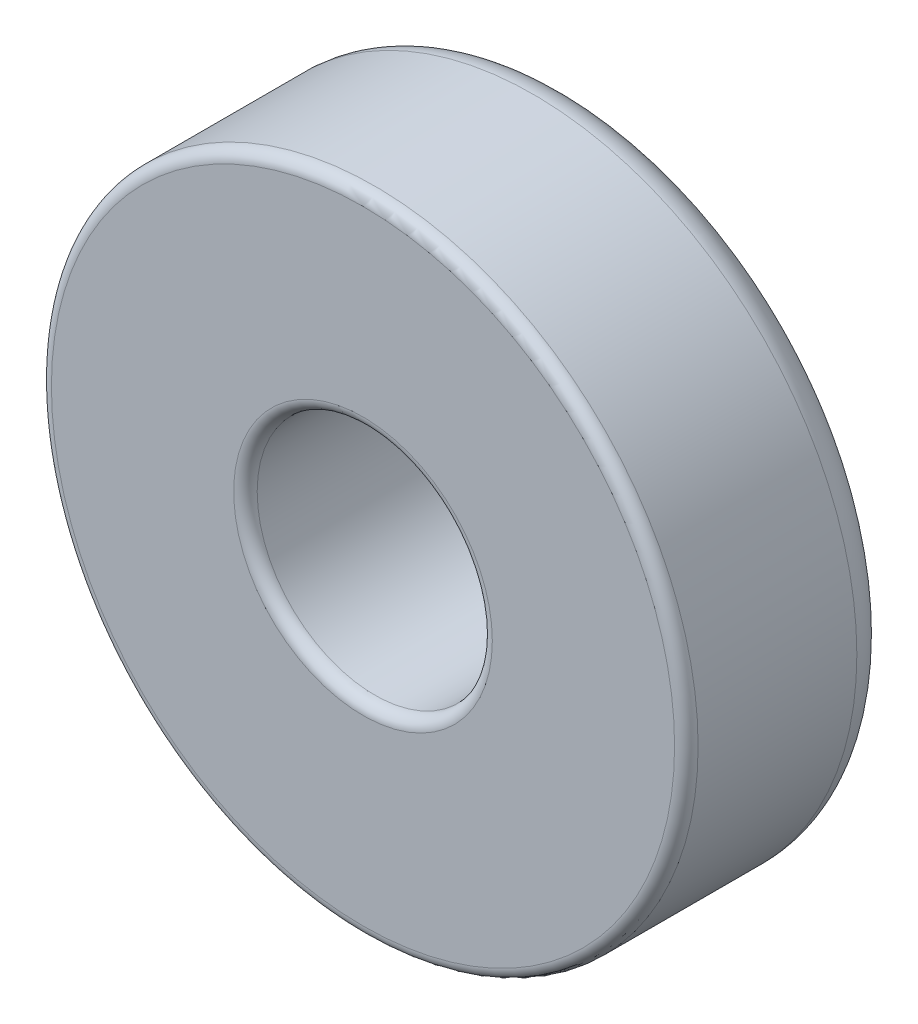
from build123d import *

# Parameters (mm, degrees)
SKETCH_1_R      = 2.75
SKETCH_1_R_2    = 1
EXTRUDE_1_DEPTH = 1.75
FILLET_1_R      = 0.3
FILLET_2_R      = 0.1


with BuildPart() as part:
    # 草图1 → 拉伸-薄壁1 (new body)
    with BuildSketch(Plane.XY):
        Circle(SKETCH_1_R)
        Circle(SKETCH_1_R_2, mode=Mode.SUBTRACT)
    extrude(amount=EXTRUDE_1_DEPTH)

    # 圆角1
    fillet_1_edges = [part.edges().sort_by_distance(p)[0] for p in [
        (-2.75, 0, 0),
    ]]
    fillet(fillet_1_edges, radius=FILLET_1_R)

    # 圆角2
    fillet_2_edges = [part.edges().sort_by_distance(p)[0] for p in [
        (-1, 0, 0),
        (-2.75, 0, 1.75),
        (-1, 0, 1.75),
    ]]
    fillet(fillet_2_edges, radius=FILLET_2_R)


solid = part.part
